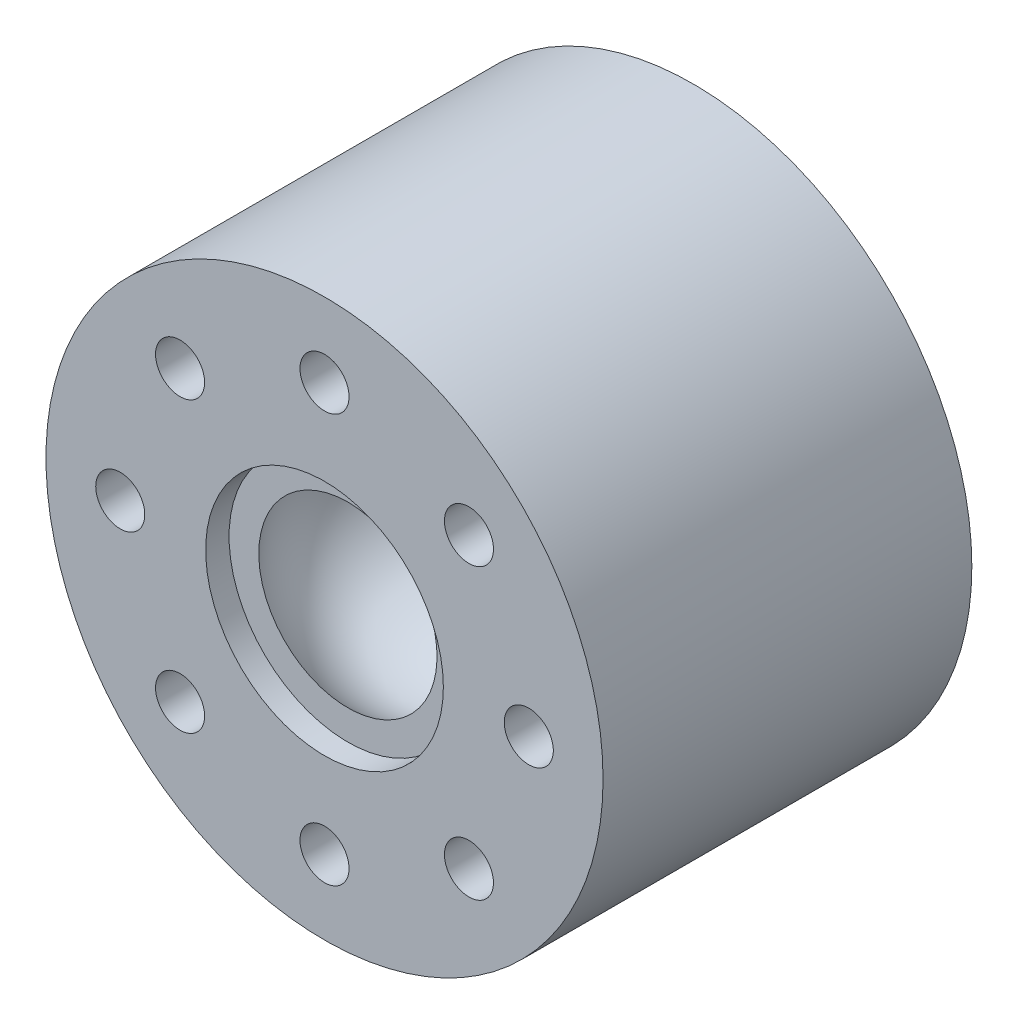
from build123d import *

# Parameters (mm, degrees)
BOSS_EXTRUDE1_DEPTH      = 55
BOSS_EXTRUDE1_DEPTH_BACK = 10
SKETCH1_R                = 37.5
SKETCH2_R                = 16
CUT_EXTRUDE1_DEPTH       = 16
SKETCH3_R                = 16
CUT_EXTRUDE2_DEPTH       = 2.5
SKETCH6_R                = 8.9296875
CUT_EXTRUDE3_DEPTH       = 23
SKETCH7_R                = 37.5
CUT_EXTRUDE4_DEPTH       = 15.35
SKETCH9_R                = 3.302
BOLT_HOLES_DEPTH         = 73.647247023


with BuildPart() as part:
    # Sketch1 → Boss-Extrude1 (new, two sides: drawn at the far end of the back side and taken through both)
    with BuildSketch(Plane.XY.offset(-BOSS_EXTRUDE1_DEPTH_BACK)):
        Circle(SKETCH1_R)
    extrude(amount=BOSS_EXTRUDE1_DEPTH + BOSS_EXTRUDE1_DEPTH_BACK)

    # Sketch2 → Cut-Extrude1 (cut)
    with BuildSketch(Plane.XY.offset(55)):
        Circle(SKETCH2_R)
    extrude(amount=-CUT_EXTRUDE1_DEPTH, mode=Mode.SUBTRACT)

    # Sketch3 → Cut-Extrude2 (cut)
    with BuildSketch(Plane.XY.offset(39)):
        Circle(SKETCH3_R)
    extrude(amount=-CUT_EXTRUDE2_DEPTH, mode=Mode.SUBTRACT)

    # Sketch4 → Aortic Root (revolve, cut)
    with BuildSketch(Plane(origin=(0, 0, 0), x_dir=(0, 0, -1), z_dir=(1, 0, 0)), mode=Mode.PRIVATE) as aortic_root_sk:
        with BuildLine():
            Line((-19.46, 12), (-19.46, 0))
            Line((-19.46, 0), (-36.5, 0))
            Line((-36.5, 0), (-36.5, 12))
            add(Edge.make_bspline(
                [(-36.5, 12), (-27.947018525, 19.440766671), (-19.46, 12)],
                knots=[0, 0, 0, 1, 1, 1], degree=2))
        make_face()
    revolve(aortic_root_sk.sketch.rotate(Axis((0, 0, 19.46), (0, 0, 1)), 270), axis=Axis((0, 0, 19.46), (0, 0, 1)), mode=Mode.SUBTRACT)

    # Sketch6 → Cut-Extrude3 (cut)
    with BuildSketch(Plane(origin=(0, 0, -10), x_dir=(-1, 0, 0), z_dir=(0, 0, -1))):
        Circle(SKETCH6_R)
    extrude(amount=-CUT_EXTRUDE3_DEPTH, mode=Mode.SUBTRACT)

    # Sketch7 → Cut-Extrude4 (cut)
    with BuildSketch(Plane.XY.offset(55)):
        Circle(SKETCH7_R)
    extrude(amount=-CUT_EXTRUDE4_DEPTH, mode=Mode.SUBTRACT)

    # Sketch9 → Bolt holes (cut, through all)
    with BuildSketch(Plane(origin=(0, 0, -10), x_dir=(-1, 0, 0), z_dir=(0, 0, -1))):
        with Locations((0, -27.5)):
            Circle(SKETCH9_R)
        with Locations((-19.445436483, -19.445436483)):
            Circle(SKETCH9_R)
        with Locations((-27.5, 0)):
            Circle(SKETCH9_R)
        with Locations((-19.445436483, 19.445436483)):
            Circle(SKETCH9_R)
        with Locations((0, 27.5)):
            Circle(SKETCH9_R)
        with Locations((19.445436483, 19.445436483)):
            Circle(SKETCH9_R)
        with Locations((27.5, 0)):
            Circle(SKETCH9_R)
        with Locations((19.445436483, -19.445436483)):
            Circle(SKETCH9_R)
    extrude(amount=-BOLT_HOLES_DEPTH, mode=Mode.SUBTRACT)

    # Sketch12 → Cut-Revolve1 (revolve, cut)
    with BuildSketch(Plane(origin=(0, 0, 0), x_dir=(1, 0, 0), z_dir=(0, 1, 0))):
        Polygon((0, -19.46), (0, -13), (8.9296875, -13), (12, -19.46), align=None)
    revolve(axis=Axis((0, 0, 19.46), (0, 0, -1)), mode=Mode.SUBTRACT)


solid = part.part
